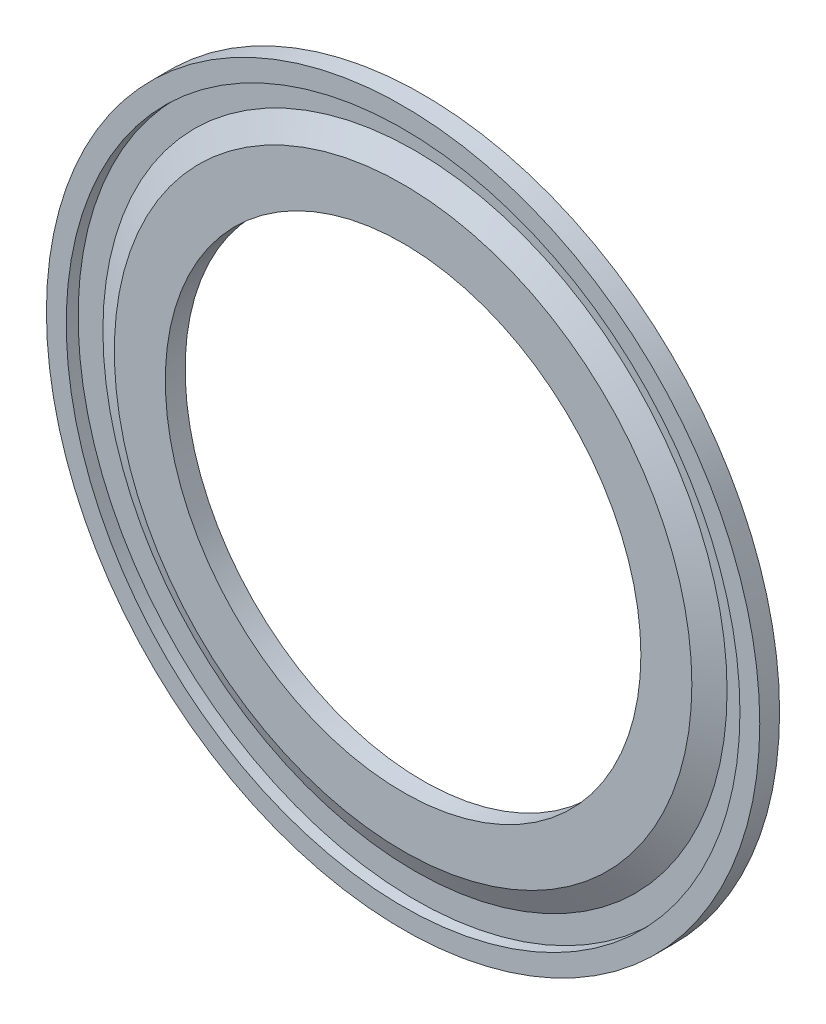
from build123d import *


with BuildPart() as part:
    # Esquisse1 → Révolution1 (revolve)
    with BuildSketch(Plane(origin=(0, 0, 0), x_dir=(0, 0, -1), z_dir=(1, 0, 0)), mode=Mode.PRIVATE) as r_volution1_sk:
        Polygon((-0.5, 17), (0.1, 17), (0.1, 15.75), (-0.5, 14.572433697), (-0.5, 12), (0.5, 12), (0.5, 18), (-0.5, 18), align=None)
    revolve(r_volution1_sk.sketch.rotate(Axis((0, 0, 0), (0, 0, -1)), 90), axis=Axis((0, 0, 0), (0, 0, -1)))


solid = part.part
